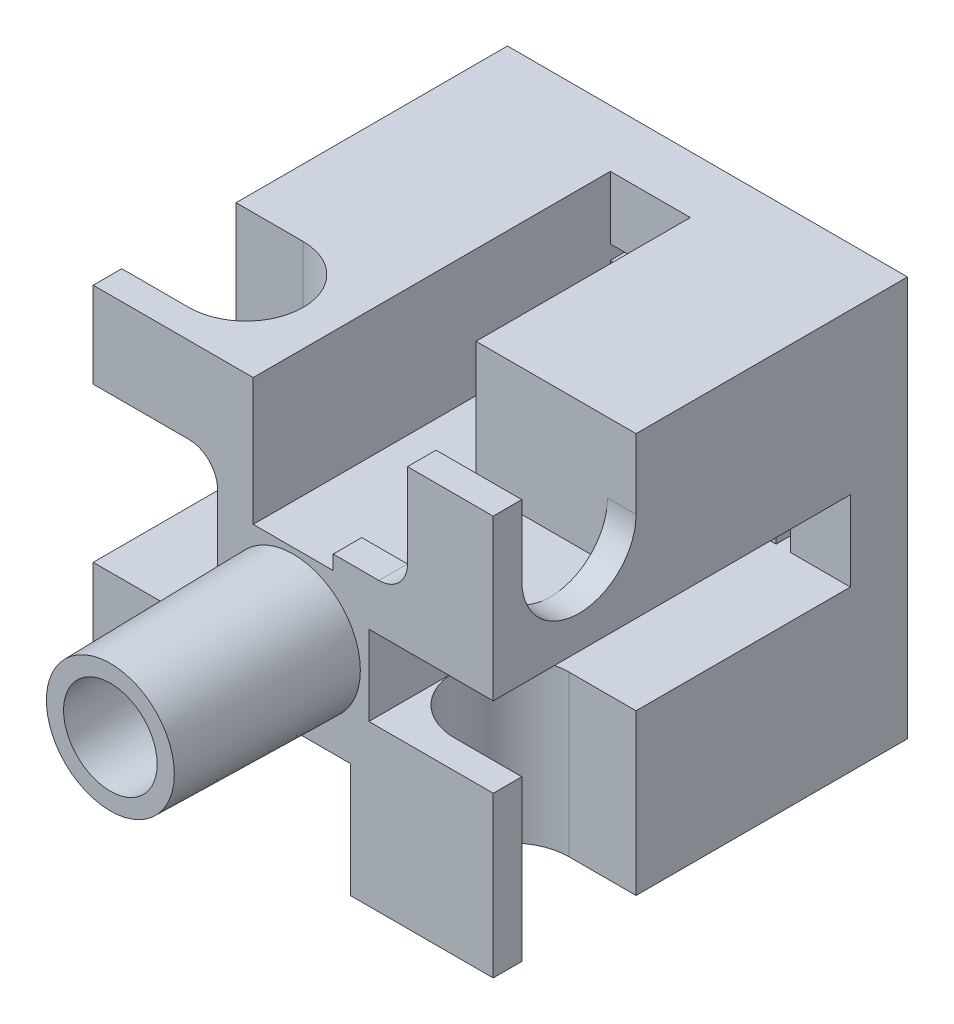
from build123d import *

# Parameters (mm, degrees)
BASES_W                            = 14
BASES_H                            = 14
BASE_DEPTH                         = 14.5
NEUTRALS_W                         = 0.5
NEUTRALS_H                         = 2.8
NEUTRAL_DEPTH                      = 18.557049866
GROUNDS_W                          = 2.8
GROUNDS_H                          = 0.5
GROUND_DEPTH                       = 18.557049866
TOP_GROUND_AREA_REACH              = 23.337
SKETCH1_W                          = 2.8
SKETCH1_H                          = 11.5
SKETCH15_W                         = 2.8
SKETCH15_H                         = 12.5
GND_POCKET_EXTRA_CUT_DEPTH         = 1.75
SIDE_GROUND_AREA_DEPTH             = 5
SIDE_GND_TERMINAL_SCREW_AREA_REACH = 23.337
POCKET_START                       = -1.75
SKETCH4_W                          = 7.4
SKETCH4_H                          = 4
POCKET_GND_TERMINAL_AREA_DEPTH     = 2
SKETCH6_W                          = 12.5
SKETCH6_H                          = 3.6
NEUTRAL_SIDE_AREA_CUT_DEPTH        = 4.35
NEUTRAL_SIDE_SCREW_TERMINAL_DEPTH  = 8.4
NEUTRAL_SIDE_CURVED_WALL_CUT_REACH = 19.557
SKETCH8_W                          = 12.5
SKETCH8_H                          = 2.8
LINE_AREA_CUT_DEPTH                = 4.35
LINE_SIDE_SCREW_TERMINAL_REACH     = 23.337
SKETCH10_W                         = 7
SKETCH10_H                         = 12.3
BOTTOM_POCKET_DEPTH                = 4
SKETCH11_R                         = 2.5
FASTENER_TOP_BORE_DEPTH            = 0.5
SKETCH13_R                         = 2.35
FASTENER_BOSS_DEPTH                = 6.4
FASTENER_BOSS_TAPER                = 1
SKETCH12_R                         = 2
SKETCH14_R                         = 1.638287584


with BuildPart() as part:
    # BaseS → BASE (new body)
    with BuildSketch(Plane.XY):
        Rectangle(BASES_W, BASES_H)
    extrude(amount=BASE_DEPTH)

    # NeutralS → NEUTRAL (cut, through all)
    with BuildSketch(Plane(origin=(0, 0, 0), x_dir=(-1, 0, 0), z_dir=(0, 0, -1))):
        with Locations((4.65, 0)):
            Rectangle(NEUTRALS_W, NEUTRALS_H)
    neutral = extrude(amount=-NEUTRAL_DEPTH, mode=Mode.SUBTRACT)

    # LINE HM: NEUTRAL across plane
    add(neutral.mirror(Plane(origin=(0, 0, 0), x_dir=(0, 0, 1), z_dir=(1, 0, 0))), mode=Mode.SUBTRACT)

    # GroundS → GROUND (cut, through all)
    with BuildSketch(Plane(origin=(0, 0, 0), x_dir=(-1, 0, 0), z_dir=(0, 0, -1))):
        with Locations((0, 4.55)):
            Rectangle(GROUNDS_W, GROUNDS_H)
    extrude(amount=-GROUND_DEPTH, mode=Mode.SUBTRACT)

    # Sketch1 → TOP GROUND AREA (cut, up to next)
    with BuildSketch(Plane(origin=(0, 7, 0), x_dir=(1, 0, 0), z_dir=(0, 1, 0)), mode=Mode.PRIVATE) as top_ground_area_sk1:
        with Locations((0, -7.75)):
            Rectangle(SKETCH1_W, SKETCH1_H)
    top_ground_area_tool1 = extrude(top_ground_area_sk1.sketch, amount=-TOP_GROUND_AREA_REACH, mode=Mode.PRIVATE) & part.part
    add(top_ground_area_tool1.solids().sort_by_distance((0, 7, 7.75))[0], mode=Mode.SUBTRACT)

    # Sketch15 → GND POCKET EXTRA CUT (cut)
    with BuildSketch(Plane(origin=(0, 4.3, 0), x_dir=(1, 0, 0), z_dir=(0, 1, 0))):
        with Locations((0, -8.25)):
            Rectangle(SKETCH15_W, SKETCH15_H)
    extrude(amount=-GND_POCKET_EXTRA_CUT_DEPTH, mode=Mode.SUBTRACT)

    # Sketch2 → SIDE GROUND AREA (cut)
    with BuildSketch(Plane.XY.offset(14.5)):
        with BuildLine():
            Line((4, 7), (4, 4.05))
            ThreePointArc((4, 4.05), (3.707106781, 3.342893219), (3, 3.05))
            Line((3, 3.05), (0.6, 3.05))
            Line((0.6, 3.05), (0.6, 2.55))
            Line((0.6, 2.55), (-1.4, 2.55))
            Line((-1.4, 2.55), (-1.4, 7))
            Line((-1.4, 7), (4, 7))
        make_face()
    extrude(amount=-SIDE_GROUND_AREA_DEPTH, mode=Mode.SUBTRACT)

    # SIDE GND TERMINAL SCREW AREA: up to this face of the body (flat: up to its plane)
    side_gnd_terminal_screw_area_end = Plane(part.part.faces().sort_by_distance((1.4, 4.635, 6.044915254))[0])
    # Sketch3 → SIDE GND TERMINAL SCREW AREA (cut, up to the picked face)
    with BuildSketch(Plane(origin=(7, 0, 0), x_dir=(0, 0, -1), z_dir=(1, 0, 0)), mode=Mode.PRIVATE) as side_gnd_terminal_screw_area_sk1:
        with BuildLine():
            Line((-9.5, 9.45), (-9.5, 4.55))
            ThreePointArc((-9.5, 4.55), (-11.5, 2.55), (-13.5, 4.55))
            Line((-13.5, 4.55), (-13.5, 9.45))
            ThreePointArc((-13.5, 9.45), (-11.5, 11.45), (-9.5, 9.45))
        make_face()
    side_gnd_terminal_screw_area_tool1 = split(extrude(side_gnd_terminal_screw_area_sk1.sketch, amount=-SIDE_GND_TERMINAL_SCREW_AREA_REACH, mode=Mode.PRIVATE), bisect_by=side_gnd_terminal_screw_area_end, keep=Keep.BOTH, mode=Mode.PRIVATE)
    add(side_gnd_terminal_screw_area_tool1.solids().sort_by(Axis((7, 7, 11.5), (-1, 0, 0)))[0], mode=Mode.SUBTRACT)

    # Sketch4 → POCKET GND TERMINAL AREA (cut)
    with BuildSketch(Plane(origin=(0, 4.3, 0), x_dir=(1, 0, 0), z_dir=(0, 1, 0)).offset(POCKET_START)):
        with Locations((2.3, -11.5)):
            Rectangle(SKETCH4_W, SKETCH4_H)
    extrude(amount=POCKET_GND_TERMINAL_AREA_DEPTH, mode=Mode.SUBTRACT)

    # Sketch6 → NEUTRAL SIDE AREA CUT (cut)
    with BuildSketch(Plane.ZY.offset(7)):
        with Locations((8.25, 0.4)):
            Rectangle(SKETCH6_W, SKETCH6_H)
    extrude(amount=-NEUTRAL_SIDE_AREA_CUT_DEPTH, mode=Mode.SUBTRACT)

    # Sketch5 → NEUTRAL SIDE SCREW TERMINAL (cut)
    with BuildSketch(Plane(origin=(0, 7, 0), x_dir=(1, 0, 0), z_dir=(0, 1, 0))):
        with BuildLine():
            Line((-9.35, -9.5), (-4.65, -9.5))
            ThreePointArc((-4.65, -9.5), (-2.65, -11.5), (-4.65, -13.5))
            Line((-4.65, -13.5), (-9.35, -13.5))
            ThreePointArc((-9.35, -13.5), (-11.35, -11.5), (-9.35, -9.5))
        make_face()
    extrude(amount=-NEUTRAL_SIDE_SCREW_TERMINAL_DEPTH, mode=Mode.SUBTRACT)

    # Sketch7 → NEUTRAL SIDE CURVED WALL CUT (cut, up to next)
    with BuildSketch(Plane.XY.offset(14.5), mode=Mode.PRIVATE) as neutral_side_curved_wall_cut_sk1:
        with BuildLine():
            Line((-7, 2.2), (-2.65, 2.2))
            Line((-2.65, 2.2), (-2.65, 3))
            ThreePointArc((-2.65, 3), (-2.942893219, 3.707106781), (-3.65, 4))
            Line((-3.65, 4), (-7, 4))
            Line((-7, 4), (-7, 2.2))
        make_face()
    neutral_side_curved_wall_cut_tool1 = extrude(neutral_side_curved_wall_cut_sk1.sketch, amount=-NEUTRAL_SIDE_CURVED_WALL_CUT_REACH, mode=Mode.PRIVATE) & part.part
    add(neutral_side_curved_wall_cut_tool1.solids().sort_by_distance((-4.879997, 3.080933, 14.5))[0], mode=Mode.SUBTRACT)

    # Sketch8 → LINE AREA CUT (cut)
    with BuildSketch(Plane(origin=(7, 0, 0), x_dir=(0, 0, -1), z_dir=(1, 0, 0))):
        with Locations((-8.25, 0)):
            Rectangle(SKETCH8_W, SKETCH8_H)
    extrude(amount=-LINE_AREA_CUT_DEPTH, mode=Mode.SUBTRACT)

    # Sketch9 → LINE SIDE SCREW TERMINAL (cut, up to next)
    with BuildSketch(Plane(origin=(0, -7, 0), x_dir=(-1, 0, 0), z_dir=(0, -1, 0)), mode=Mode.PRIVATE) as line_side_screw_terminal_sk1:
        with BuildLine():
            Line((-4.65, -13.5), (-7, -13.5))
            ThreePointArc((-7, -13.5), (-9, -11.5), (-7, -9.5))
            Line((-7, -9.5), (-4.65, -9.5))
            ThreePointArc((-4.65, -9.5), (-2.65, -11.5), (-4.65, -13.5))
        make_face()
    line_side_screw_terminal_tool1 = extrude(line_side_screw_terminal_sk1.sketch, amount=-LINE_SIDE_SCREW_TERMINAL_REACH, mode=Mode.PRIVATE) & part.part
    add(line_side_screw_terminal_tool1.solids().sort_by_distance((5.825, -7, 11.5))[0], mode=Mode.SUBTRACT)

    # Sketch10 → BOTTOM POCKET (cut)
    with BuildSketch(Plane.XZ.offset(7)):
        with Locations((-1.5, 8.35)):
            Rectangle(SKETCH10_W, SKETCH10_H)
    extrude(amount=-BOTTOM_POCKET_DEPTH, mode=Mode.SUBTRACT)

    # Sketch11 → FASTENER TOP BORE (cut)
    with BuildSketch(Plane(origin=(0, 0, 0), x_dir=(-1, 0, 0), z_dir=(0, 0, -1))):
        Circle(SKETCH11_R)
    extrude(amount=-FASTENER_TOP_BORE_DEPTH, mode=Mode.SUBTRACT)

    # Sketch13 → FASTENER BOSS (add)
    with BuildSketch(Plane.XY.offset(14.5)):
        Circle(SKETCH13_R)
    extrude(amount=FASTENER_BOSS_DEPTH, taper=FASTENER_BOSS_TAPER)

    # Sketch12 → FASTENER CLEARANCE HOLE section 0
    with BuildSketch(Plane(origin=(0, 0, 0.5), x_dir=(-1, 0, 0), z_dir=(0, 0, -1))):
        Circle(SKETCH12_R)
    # Sketch14 → FASTENER CLEARANCE HOLE section 1
    with BuildSketch(Plane.XY.offset(20.9)):
        Circle(SKETCH14_R)
    loft(mode=Mode.SUBTRACT)


solid = part.part
